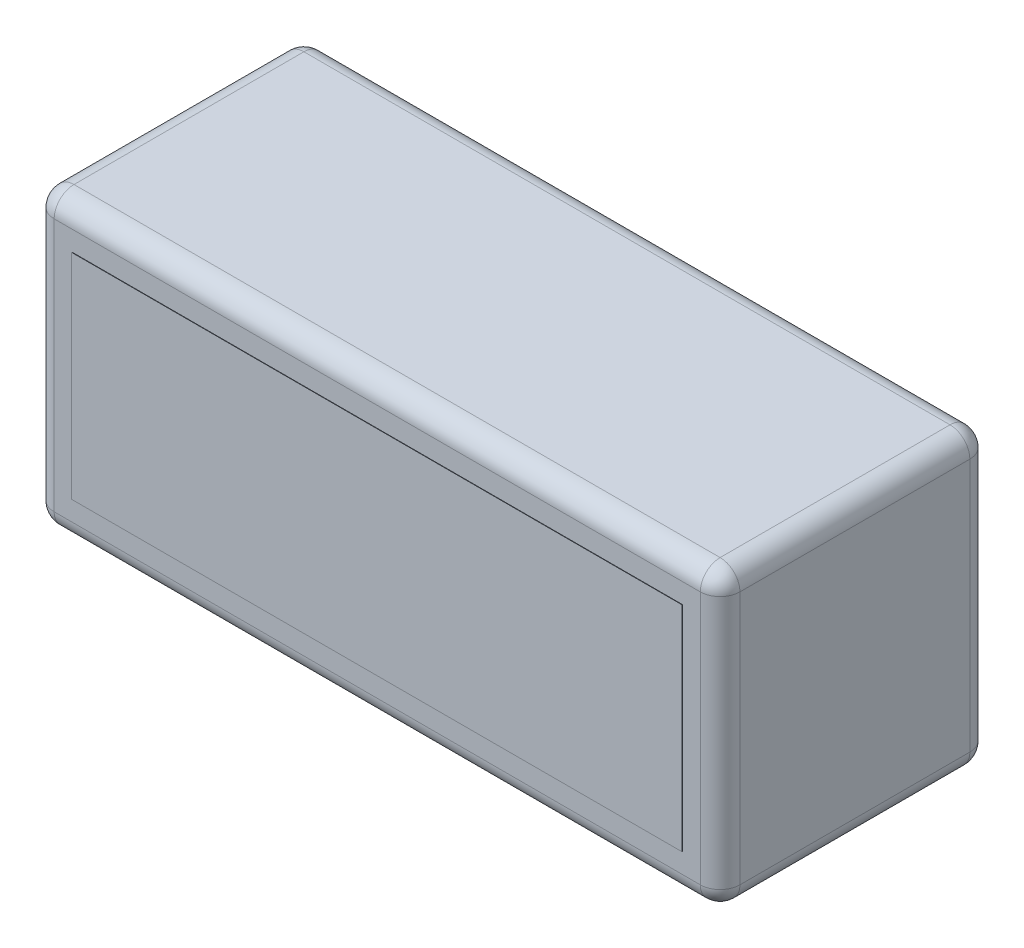
from build123d import *

# Parameters (mm, degrees)
SKETCH1_W           = 173
SKETCH1_H           = 68
BOSS_EXTRUDE1_DEPTH = 74
FILLET1_R           = 5
SKETCH2_W           = 153.991614826
SKETCH2_H           = 53.954463554
BOSS_EXTRUDE2_DEPTH = 0.1


with BuildPart() as part:
    # Sketch1 → Boss-Extrude1 (new body)
    with BuildSketch(Plane(origin=(0, 0, 0), x_dir=(1, 0, 0), z_dir=(0, 1, 0))):
        Rectangle(SKETCH1_W, SKETCH1_H)
    extrude(amount=BOSS_EXTRUDE1_DEPTH)

    # Fillet1
    fillet1_edges = [part.edges().sort_by_distance(p)[0] for p in [
        (86.5, 74, 0),
        (0, 74, -34),
        (-86.5, 74, 0),
        (0, 0, -34),
        (86.5, 0, 0),
        (0, 0, 34),
        (-86.5, 0, 0),
        (0, 74, 34),
        (-86.5, 37, -34),
        (86.5, 37, -34),
        (86.5, 37, 34),
        (-86.5, 37, 34),
    ]]
    fillet(fillet1_edges, radius=FILLET1_R)

    # Sketch2 → Boss-Extrude2 (add)
    with BuildSketch(Plane.XY.offset(34)):
        with Locations((0, 37)):
            Rectangle(SKETCH2_W, SKETCH2_H)
    extrude(amount=BOSS_EXTRUDE2_DEPTH)


solid = part.part
